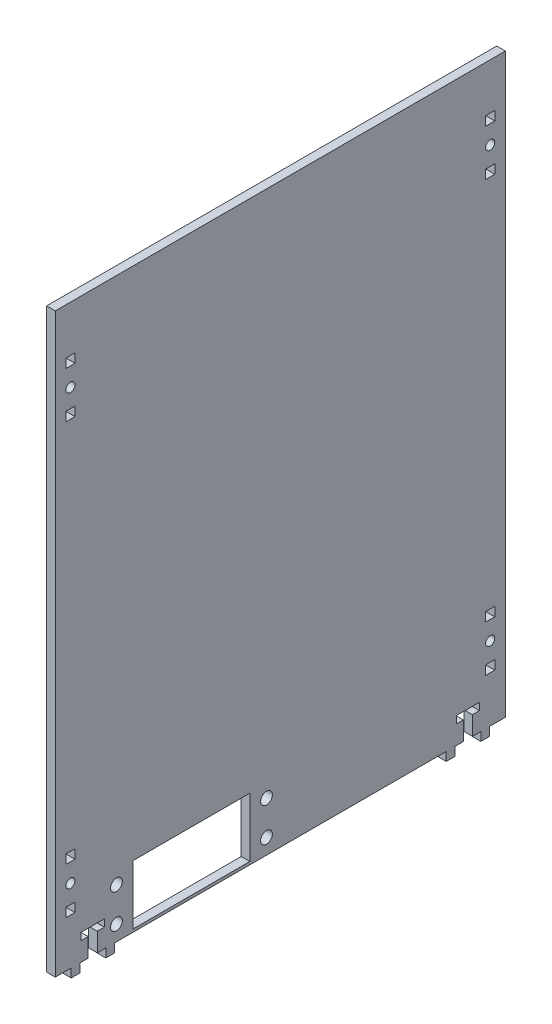
from build123d import *

# Parameters (mm, degrees)
BOSS_EXTRUDE2_DEPTH      = 1.5
BOSS_EXTRUDE2_DEPTH_BACK = 1.5
SKETCH1_R                = 1.575
SKETCH1_R_2              = 2.05
SKETCH1_W                = 40.5
SKETCH1_H                = 20.499999995
SKETCH1_W_2              = 3.15
SKETCH1_H_2              = 3.15


with BuildPart() as part:
    # Sketch1 → Boss-Extrude2 (new, two sides: drawn at the far end of the back side and taken through both)
    with BuildSketch(Plane(origin=(0, 0, 0), x_dir=(0, 0, -1), z_dir=(1, 0, 0)).offset(-BOSS_EXTRUDE2_DEPTH_BACK)):
        Polygon((11.425, 0), (8.5, 0), (8.5, -3), (5.5, -3), (5.5, 0), (0, 0), (0, 200), (156, 200), (156, 0), (150.5, 0), (150.5, -3), (147.5, -3), (147.5, 0), (144.575, 0), (144.575, 6.5), (147, 6.5), (147, 9), (139, 9), (139, 6.5), (141.425, 6.5), (141.425, 0), (138.5, 0), (138.5, -3), (135.5, -3), (135.5, 0), (20.5, 0), (20.5, -3), (17.5, -3), (17.5, 0), (14.575, 0), (14.575, 6.5), (17, 6.5), (17, 9), (9, 9), (9, 6.5), (11.425, 6.5), align=None)
        with Locations((5.25, 25.575)):
            Circle(SKETCH1_R, mode=Mode.SUBTRACT)
        with Locations((5.25, 174.425)):
            Circle(SKETCH1_R, mode=Mode.SUBTRACT)
        with Locations((150.75, 174.425)):
            Circle(SKETCH1_R, mode=Mode.SUBTRACT)
        with Locations((150.75, 25.575)):
            Circle(SKETCH1_R, mode=Mode.SUBTRACT)
        with Locations((73.2, 5.35)):
            Circle(SKETCH1_R_2, mode=Mode.SUBTRACT)
        with Locations((73.2, 17.149999995)):
            Circle(SKETCH1_R_2, mode=Mode.SUBTRACT)
        with Locations((21.2, 5.35)):
            Circle(SKETCH1_R_2, mode=Mode.SUBTRACT)
        with Locations((21.2, 17.149999995)):
            Circle(SKETCH1_R_2, mode=Mode.SUBTRACT)
        with Locations((47.2, 11.249999997)):
            Rectangle(SKETCH1_W, SKETCH1_H, mode=Mode.SUBTRACT)
        with Locations((5.25, 17.575)):
            Rectangle(SKETCH1_W_2, SKETCH1_H_2, mode=Mode.SUBTRACT)
        with Locations((5.25, 33.575)):
            Rectangle(SKETCH1_W_2, SKETCH1_H_2, mode=Mode.SUBTRACT)
        with Locations((5.25, 166.425)):
            Rectangle(SKETCH1_W_2, SKETCH1_H_2, mode=Mode.SUBTRACT)
        with Locations((5.25, 182.425)):
            Rectangle(SKETCH1_W_2, SKETCH1_H_2, mode=Mode.SUBTRACT)
        with Locations((150.75, 182.425)):
            Rectangle(SKETCH1_W_2, SKETCH1_H_2, mode=Mode.SUBTRACT)
        with Locations((150.75, 166.425)):
            Rectangle(SKETCH1_W_2, SKETCH1_H_2, mode=Mode.SUBTRACT)
        with Locations((150.75, 33.575)):
            Rectangle(SKETCH1_W_2, SKETCH1_H_2, mode=Mode.SUBTRACT)
        with Locations((150.75, 17.575)):
            Rectangle(SKETCH1_W_2, SKETCH1_H_2, mode=Mode.SUBTRACT)
    extrude(amount=BOSS_EXTRUDE2_DEPTH + BOSS_EXTRUDE2_DEPTH_BACK)


solid = part.part
